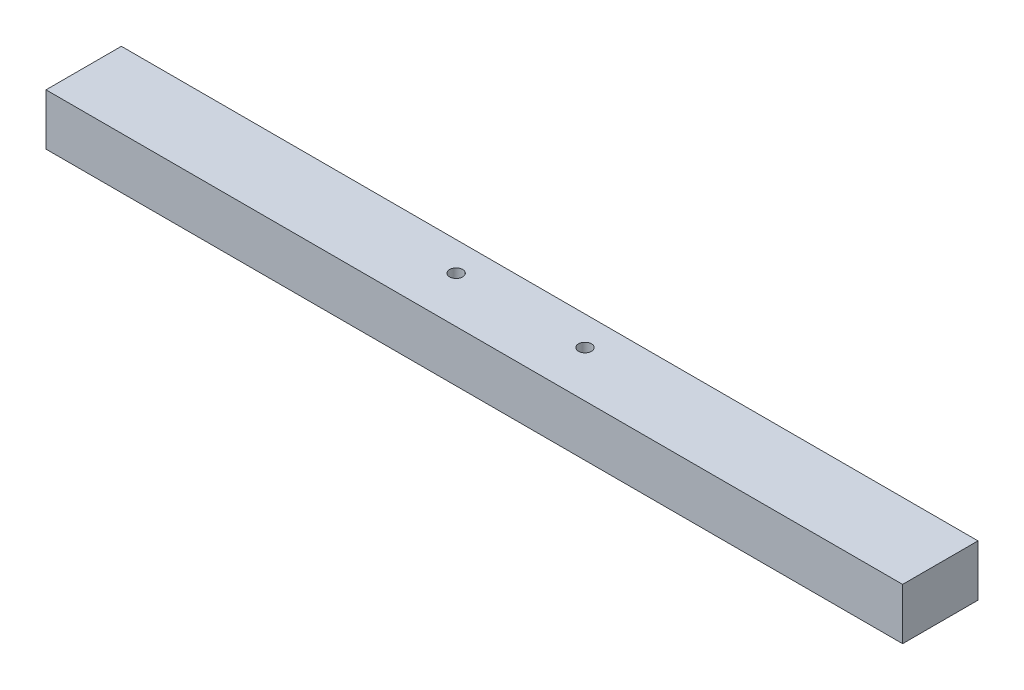
from build123d import *

# Parameters (mm, degrees)
CROQUIS1_W              = 250
CROQUIS1_H              = 22
CROQUIS1_R              = 1.9
SALIENTE_EXTRUIR1_DEPTH = 15


with BuildPart() as part:
    # Croquis1 → Saliente-Extruir1 (new body)
    with BuildSketch(Plane(origin=(0, 0, 0), x_dir=(1, 0, 0), z_dir=(0, 1, 0))):
        Rectangle(CROQUIS1_W, CROQUIS1_H)
        with Locations(Location((-18.8, 2.5, 0), (0, 0, 270))):
            Circle(CROQUIS1_R, mode=Mode.SUBTRACT)
        with Locations(Location((18.8, 2.5, 0), (0, 0, 270))):
            Circle(CROQUIS1_R, mode=Mode.SUBTRACT)
    extrude(amount=SALIENTE_EXTRUIR1_DEPTH)


solid = part.part
